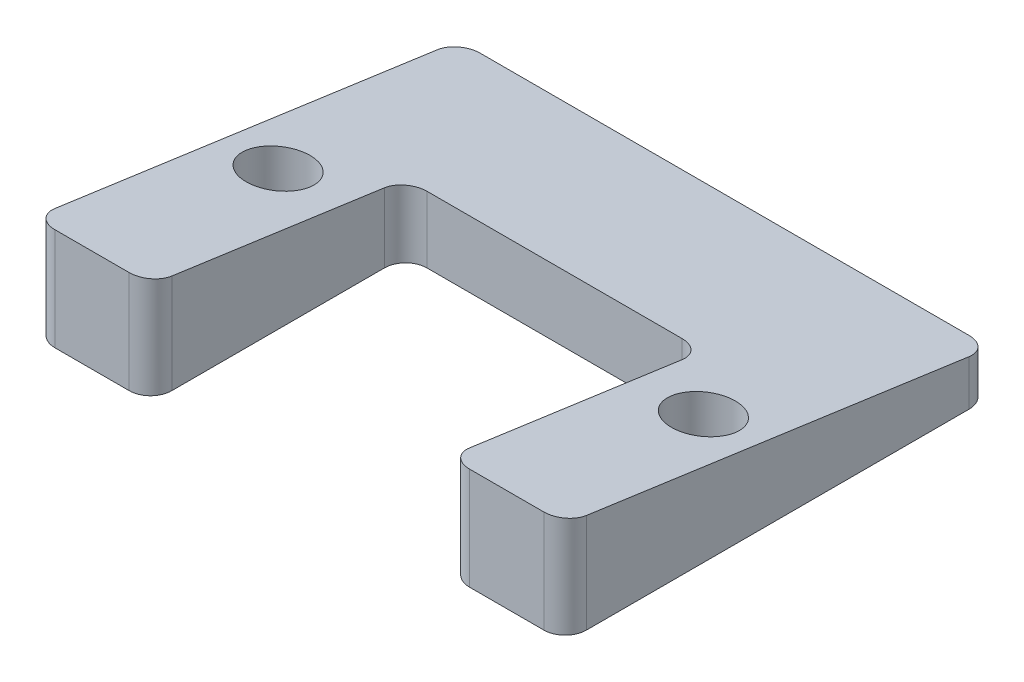
from build123d import *

# Parameters (mm, degrees)
ESQUISSE1_R             = 1.5
BOSS_EXTRU_1_DEPTH      = 10
ENL_V_MAT_EXTRU_1_DEPTH = 20.4229246
CONG_1_R                = 1


with BuildPart() as part:
    # Esquisse1 → Boss.-Extru.1 (new body)
    with BuildSketch(Plane(origin=(0, 0, 0), x_dir=(1, 0, 0), z_dir=(0, 1, 0))):
        Polygon((7, -9), (12.5, -9), (12.5, 11), (0, 11), (0, 3), (7, 3), align=None)
        with Locations(Location((10, 0, 0), (0, 0, 270))):
            Circle(ESQUISSE1_R, mode=Mode.SUBTRACT)
    extrude(amount=BOSS_EXTRU_1_DEPTH)

    # Esquisse2 → Enlèv. mat.-Extru.1 (cut, through all)
    with BuildSketch(Plane(origin=(12.5, 0, 0), x_dir=(0, 0, -1), z_dir=(1, 0, 0))):
        Polygon((-9, 10), (11, 10), (11, 2), (-9, 4.810816694), align=None)
    extrude(amount=-ENL_V_MAT_EXTRU_1_DEPTH, mode=Mode.SUBTRACT)

    # Congé1
    cong_1_edges = [part.edges().sort_by_distance(p)[0] for p in [
        (7, 1.562163339, -3),
        (12.5, 1, -11),
        (12.5, 2.405408347, 9),
        (7, 2.405408347, 9),
    ]]
    fillet(cong_1_edges, radius=CONG_1_R)

    # Symétrie1: part across plane


with BuildPart() as part_1:
    add(part.part)
    add(part.part.mirror(Plane(origin=(0, 10, -11), x_dir=(0, 0, 1), z_dir=(1, 0, 0))))


solid = part_1.part
